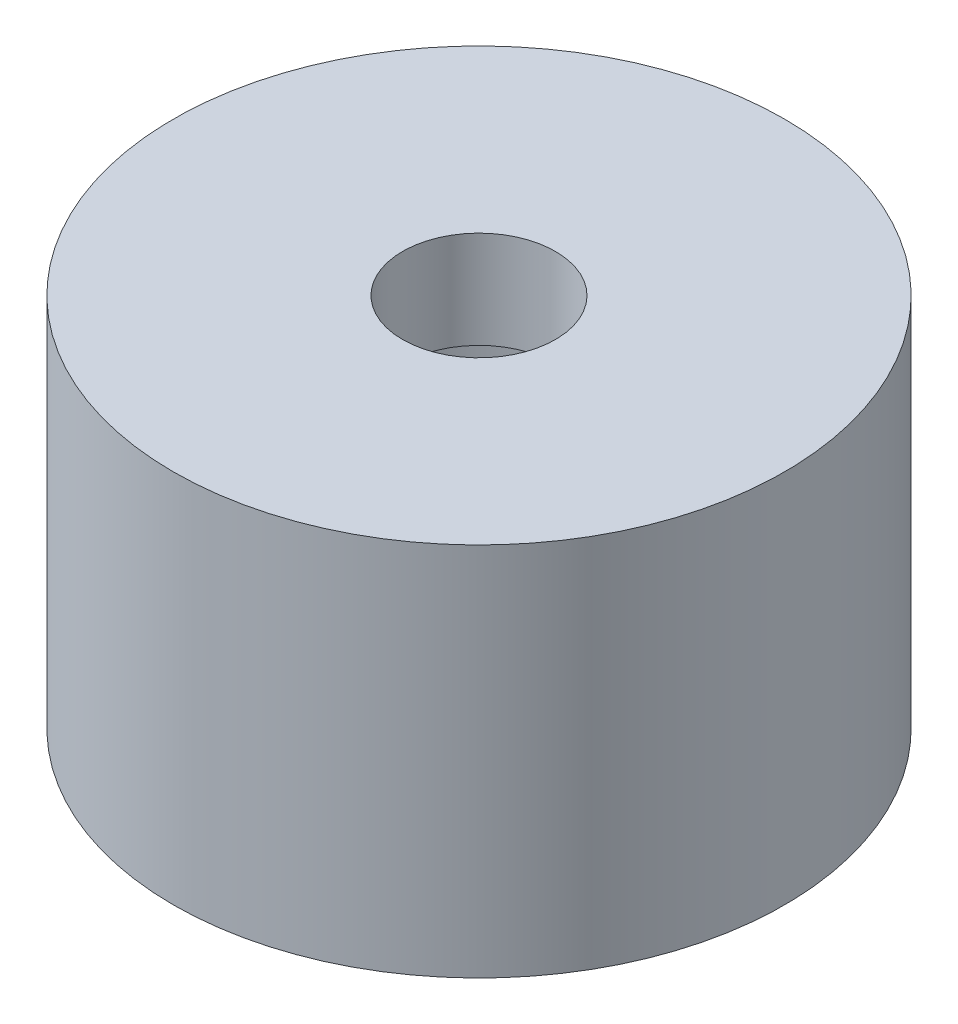
from build123d import *

# Parameters (mm, degrees)
SKETCH1_R           = 11
SKETCH1_R_2         = 7
BOSS_EXTRUDE1_DEPTH = 10
SKETCH2_R           = 11
SKETCH2_R_2         = 2.75
BOSS_EXTRUDE2_DEPTH = 3.5


with BuildPart() as part:
    # Sketch1 → Boss-Extrude1 (new body)
    with BuildSketch(Plane(origin=(0, 0, 0), x_dir=(1, 0, 0), z_dir=(0, 1, 0))):
        with Locations(Location((0, 0, 0), (0, 0, 270))):
            Circle(SKETCH1_R)
        with Locations(Location((0, 0, 0), (0, 0, 270))):
            Circle(SKETCH1_R_2, mode=Mode.SUBTRACT)
    extrude(amount=BOSS_EXTRUDE1_DEPTH)

    # Sketch2 → Boss-Extrude2 (add)
    with BuildSketch(Plane(origin=(0, 10, 0), x_dir=(1, 0, 0), z_dir=(0, 1, 0))):
        with Locations(Location((0, 0, 0), (0, 0, 270))):
            Circle(SKETCH2_R)
        with Locations(Location((0, 0, 0), (0, 0, 270))):
            Circle(SKETCH2_R_2, mode=Mode.SUBTRACT)
    extrude(amount=BOSS_EXTRUDE2_DEPTH)


solid = part.part
